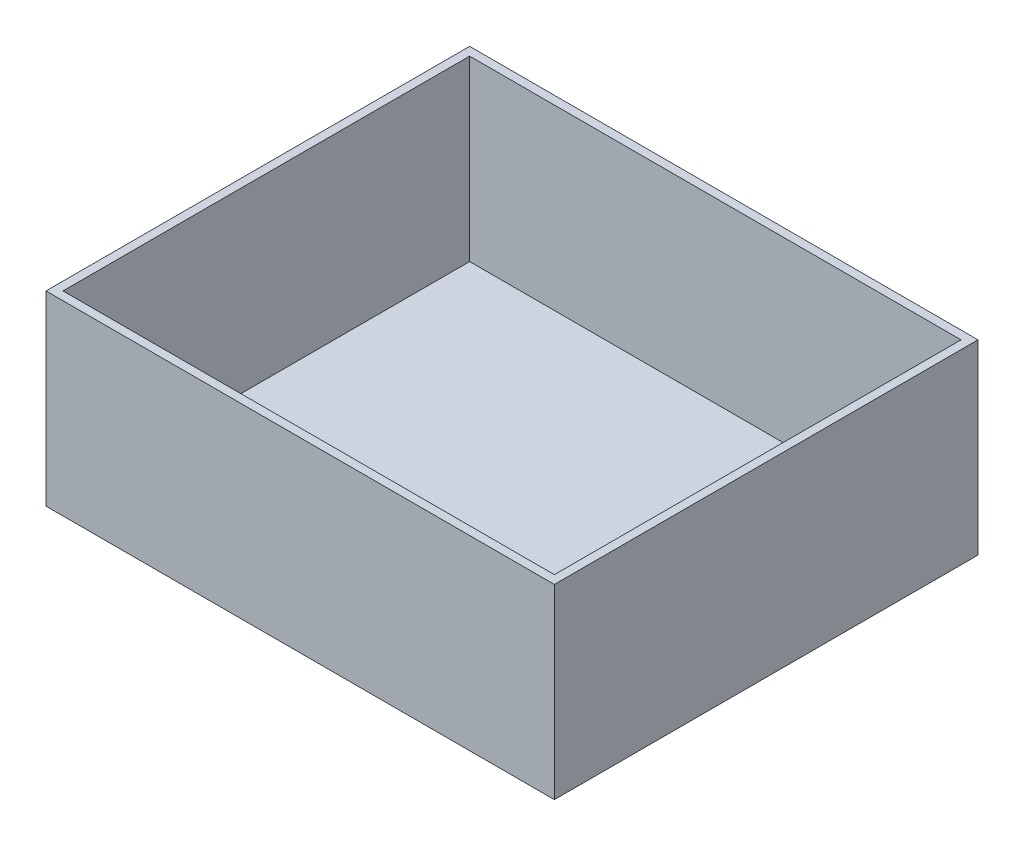
from build123d import *

# Parameters (mm, degrees)
SKETCH1_W           = 180
SKETCH1_H           = 150
BOSS_EXTRUDE1_DEPTH = 66
SHELL1_T            = -3


with BuildPart() as part:
    # Sketch1 → Boss-Extrude1 (new body)
    with BuildSketch(Plane(origin=(0, 0, 0), x_dir=(1, 0, 0), z_dir=(0, 1, 0))):
        Rectangle(SKETCH1_W, SKETCH1_H)
    extrude(amount=BOSS_EXTRUDE1_DEPTH)

    # Shell1
    shell1_openings = [part.faces().sort_by_distance(p)[0] for p in [
        (0, 66, 0),
    ]]
    offset(amount=SHELL1_T, openings=shell1_openings, kind=Kind.INTERSECTION)


solid = part.part
